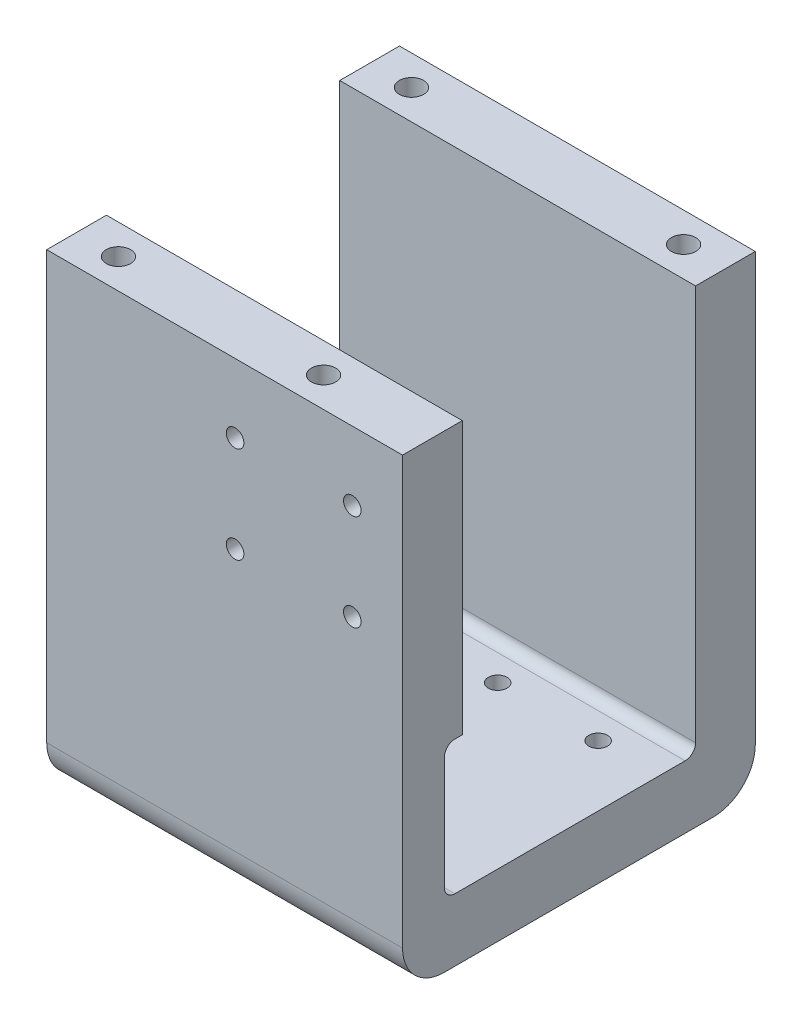
from build123d import *

# Parameters (mm, degrees)
SKETCH1_W           = 85
SKETCH1_H           = 60
BOSS_EXTRUDE1_DEPTH = 7.5
SKETCH2_R           = 2.25
CUT_EXTRUDE1_DEPTH  = 55.141019569
SKETCH3_W           = 85
SKETCH3_H           = 112
BOSS_EXTRUDE2_DEPTH = 10
FILLET1_R           = 10
SKETCH4_W           = 85
SKETCH4_H           = 65
BOSS_EXTRUDE3_DEPTH = 4.27
SKETCH5_W           = 85
SKETCH5_H           = 112
BOSS_EXTRUDE4_DEPTH = 14.27
FILLET2_R           = 10
FILLET3_R           = 2.5
FILLET4_R           = 2.5
FILLET5_R           = 2.5
SKETCH8_R           = 2.9
CUT_EXTRUDE2_DEPTH  = 25
SKETCH9_R           = 2.1
CUT_EXTRUDE3_DEPTH  = 14.27
SKETCH6_R           = 2.9
CUT_EXTRUDE4_DEPTH  = 25


with BuildPart() as part:
    # Sketch1 → Boss-Extrude1 (new, symmetric)
    with BuildSketch(Plane(origin=(0, 0, 0), x_dir=(1, 0, 0), z_dir=(0, 1, 0))):
        Rectangle(SKETCH1_W, SKETCH1_H)
    extrude(amount=BOSS_EXTRUDE1_DEPTH, both=True)

    # Sketch2 → Cut-Extrude1 (cut, through all)
    with BuildSketch(Plane(origin=(0, 7.5, 0), x_dir=(1, 0, 0), z_dir=(0, 1, 0))):
        with Locations(Location((3.95, -20.73, 0), (0, 0, 270))):
            Circle(SKETCH2_R)
        with Locations(Location((3.95, 21.27, 0), (0, 0, 270))):
            Circle(SKETCH2_R)
        with Locations(Location((27.95, 21.27, 0), (0, 0, 270))):
            Circle(SKETCH2_R)
        with Locations(Location((27.95, -20.73, 0), (0, 0, 270))):
            Circle(SKETCH2_R)
    extrude(amount=-CUT_EXTRUDE1_DEPTH, mode=Mode.SUBTRACT)

    # Sketch3 → Boss-Extrude2 (add)
    with BuildSketch(Plane.XY.offset(30)):
        with Locations((0, 48.5)):
            Rectangle(SKETCH3_W, SKETCH3_H)
    extrude(amount=BOSS_EXTRUDE2_DEPTH)

    # Fillet1
    fillet1_edges = [part.edges().sort_by_distance(p)[0] for p in [
        (0, -7.5, 40),
    ]]
    fillet(fillet1_edges, radius=FILLET1_R)

    # Sketch4 → Boss-Extrude3 (add)
    with BuildSketch(Plane(origin=(0, 0, 30), x_dir=(-1, 0, 0), z_dir=(0, 0, -1))):
        with Locations((0, 72)):
            Rectangle(SKETCH4_W, SKETCH4_H)
    extrude(amount=BOSS_EXTRUDE3_DEPTH)

    # Sketch5 → Boss-Extrude4 (add)
    with BuildSketch(Plane(origin=(0, 0, -30), x_dir=(-1, 0, 0), z_dir=(0, 0, -1))):
        with Locations((0, 48.5)):
            Rectangle(SKETCH5_W, SKETCH5_H)
    extrude(amount=BOSS_EXTRUDE4_DEPTH)

    # Fillet2
    fillet2_edges = [part.edges().sort_by_distance(p)[0] for p in [
        (0, -7.5, -44.27),
    ]]
    fillet(fillet2_edges, radius=FILLET2_R)

    # Fillet3
    fillet3_edges = [part.edges().sort_by_distance(p)[0] for p in [
        (0, 7.5, -30),
    ]]
    fillet(fillet3_edges, radius=FILLET3_R)

    # Fillet4
    fillet4_edges = [part.edges().sort_by_distance(p)[0] for p in [
        (0, 7.5, 30),
    ]]
    fillet(fillet4_edges, radius=FILLET4_R)

    # Fillet5
    fillet5_edges = [part.edges().sort_by_distance(p)[0] for p in [
        (0, 39.5, 30),
    ]]
    fillet(fillet5_edges, radius=FILLET5_R)

    # Sketch8 → Cut-Extrude2 (cut)
    with BuildSketch(Plane(origin=(0, 104.5, 0), x_dir=(1, 0, 0), z_dir=(0, 1, 0))):
        with Locations(Location((32.5, 37.135, 0), (0, 0, 270))):
            Circle(SKETCH8_R)
        with Locations(Location((-32.5, -32.865, 0), (0, 0, 270))):
            Circle(SKETCH8_R)
        with Locations(Location((-32.5, 37.135, 0), (0, 0, 270))):
            Circle(SKETCH8_R)
        with Locations(Location((16.5, -32.865, 0), (0, 0, 270))):
            Circle(SKETCH8_R)
    extrude(amount=-CUT_EXTRUDE2_DEPTH, mode=Mode.SUBTRACT)

    # Sketch9 → Cut-Extrude3 (cut)
    with BuildSketch(Plane.XY.offset(40)):
        with Locations((30.5, 88.06)):
            Circle(SKETCH9_R)
        with Locations((30.5, 65.06)):
            Circle(SKETCH9_R)
        with Locations((2.5, 65.06)):
            Circle(SKETCH9_R)
        with Locations((2.5, 88.06)):
            Circle(SKETCH9_R)
    extrude(amount=-CUT_EXTRUDE3_DEPTH, mode=Mode.SUBTRACT)

    # Sketch6 → Cut-Extrude4 (cut)
    with BuildSketch(Plane.ZY.offset(42.5)):
        with Locations((-37.135, 58.5)):
            Circle(SKETCH6_R)
        with Locations((32.865, 58.5)):
            Circle(SKETCH6_R)
        with Locations((-2.135, 0)):
            Circle(SKETCH6_R)
    extrude(amount=-CUT_EXTRUDE4_DEPTH, mode=Mode.SUBTRACT)


solid = part.part
